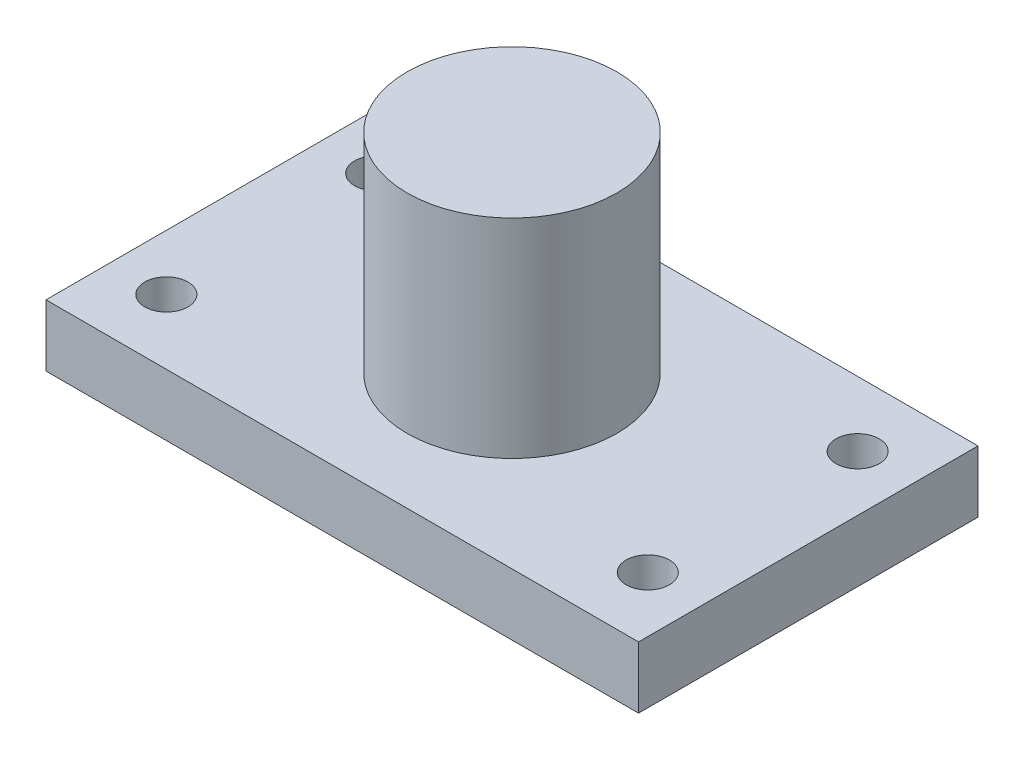
from build123d import *

# Parameters (mm, degrees)
SKETCH_1_W               = 48
SKETCH_1_H               = 27.5
EXTRUDE_1_DEPTH          = 5
SKETCH_2_R               = 8.5
EXTRUDE_2_DEPTH          = 16.87
CUT_EXTRUDE_1_DEPTH      = 60.485686514
CUT_EXTRUDE_1_DEPTH_BACK = 60.485686514
SKETCH_3_R               = 1.75


with BuildPart() as part:
    # 草图1 → 凸台-拉伸1 (new body)
    with BuildSketch(Plane(origin=(0, 0, 0), x_dir=(1, 0, 0), z_dir=(0, 1, 0))):
        with Locations((24, -13.75)):
            Rectangle(SKETCH_1_W, SKETCH_1_H)
    extrude(amount=EXTRUDE_1_DEPTH)

    # 草图2 → 凸台-拉伸2 (add)
    with BuildSketch(Plane(origin=(0, 5, 0), x_dir=(1, 0, 0), z_dir=(0, 1, 0))):
        with Locations(Location((24, -13.75, 0), (0, 0, 270))):
            Circle(SKETCH_2_R)
    extrude(amount=EXTRUDE_2_DEPTH)

    # 草图3 → 切除-拉伸1 (cut, two sides: drawn at the far end of the back side and taken through both)
    with BuildSketch(Plane.XZ.offset(-CUT_EXTRUDE_1_DEPTH_BACK)):
        with Locations(Location((4.5, 22.25, 0), (0, 0, 270))):
            Circle(SKETCH_3_R)
        with Locations(Location((43.5, 22.25, 0), (0, 0, 270))):
            Circle(SKETCH_3_R)
        with Locations(Location((43.5, 5.25, 0), (0, 0, 270))):
            Circle(SKETCH_3_R)
        with Locations(Location((4.5, 5.25, 0), (0, 0, 270))):
            Circle(SKETCH_3_R)
    extrude(amount=CUT_EXTRUDE_1_DEPTH + CUT_EXTRUDE_1_DEPTH_BACK, mode=Mode.SUBTRACT)


solid = part.part
